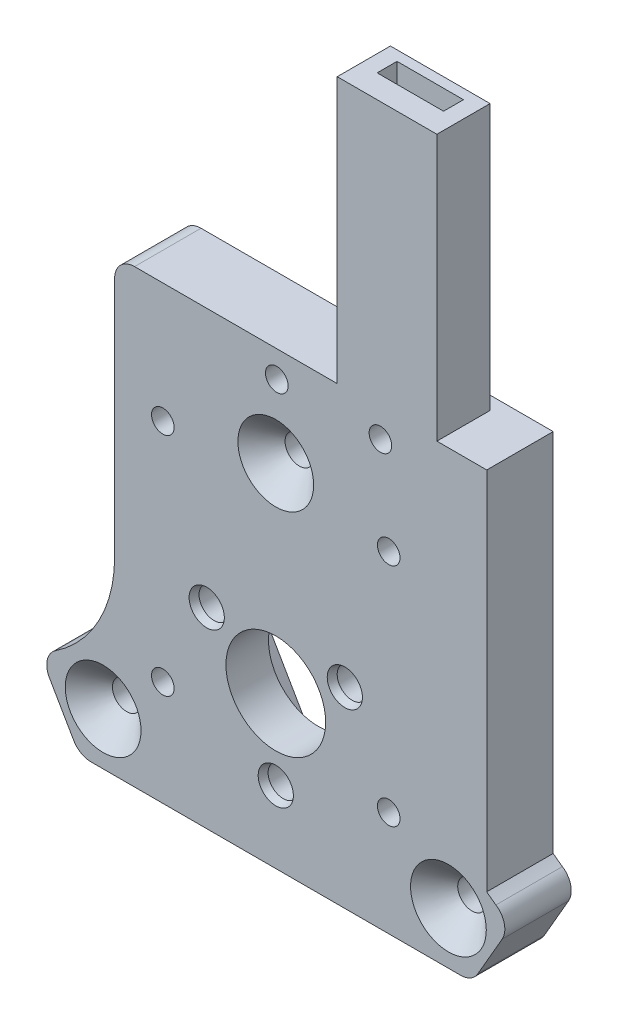
from build123d import *

# Parameters (mm, degrees)
SKETCH2_R                                       = 7.5
BOSS_EXTRUDE1_DEPTH                             = 10
CSK_FOR_M4_FLAT_HEAD_MACHINE_SCREW1_D           = 4.3
CSK_FOR_M4_FLAT_HEAD_MACHINE_SCREW1_CSINK_D     = 11.4
CSK_FOR_M4_FLAT_HEAD_MACHINE_SCREW1_CSINK_ANGLE = 90
FILLET1_R                                       = 20
V_GROOVE_CUTOUT_DEPTH                           = 3.6
STANDARD_TAPERED_INSERT_CUTOUT_DEPTH            = 59.209110795
STANDARD_TAPERED_INSERT_CUTOUT_DEPTH_BACK       = 59.209110795
SKETCH13_R                                      = 2.25
TAPER_FOR_INSERTS_SIZE                          = 0.4
TAPER_FOR_INSERTS_SIZE2                         = 1.098990968
MOVE_FACE1_BY                                   = 0.5
MOVE_FACE1_2_BY                                 = 0.5
MOVE_FACE1_3_BY                                 = 0.5
MOVE_FACE1_4_BY                                 = 0.5
MOVE_FACE1_5_BY                                 = 0.5
MOVE_FACE1_6_BY                                 = 0.5
CIRPATTERN2_COUNT                               = 3
FILLET2_R                                       = 3
SKETCH47_R                                      = 1.7
CUT_EXTRUDE1_DEPTH                              = 58.559983963
SKETCH49_W                                      = 15
SKETCH49_H                                      = 10
SKETCH49_W_2                                    = 10
SKETCH49_H_2                                    = 3
BOSS_EXTRUDE2_DEPTH                             = 40
CHAMFER1_SIZE                                   = 2
BOSS_EXTRUDE3_REACH                             = 78.74
SKETCH51_W                                      = 3
SKETCH51_H                                      = 10
BOSS_EXTRUDE4_DEPTH                             = 10
SKETCH48_R                                      = 1.7
CUT_EXTRUDE2_DEPTH                              = 93.266742447
CHAMFER4_SIZE                                   = 2
CHAMFER3_SIZE                                   = 2


with BuildPart() as part:
    # Sketch2 → Boss-Extrude1 (new body)
    with BuildSketch(Plane.XY):
        Polygon((-24.25, 45), (24.25, 45), (24.25, -5.917840259), (35.54293994, -12.437822174), (29.54293994, -22.830127019), (-29.54293994, -22.830127019), (-35.54293994, -12.437822174), (-24.25, -5.917840259), align=None)
        Circle(SKETCH2_R, mode=Mode.SUBTRACT)
    extrude(amount=BOSS_EXTRUDE1_DEPTH)

    # CSK for M4 Flat Head Machine Screw1 (through all)
    with Locations(Plane.XY.offset(10)):
        with Locations((-25.980762114, -15), (0, 30), (25.980762114, -15)):
            CounterSinkHole(CSK_FOR_M4_FLAT_HEAD_MACHINE_SCREW1_D / 2, CSK_FOR_M4_FLAT_HEAD_MACHINE_SCREW1_CSINK_D / 2, counter_sink_angle=CSK_FOR_M4_FLAT_HEAD_MACHINE_SCREW1_CSINK_ANGLE)

    # Fillet1
    fillet1_edges = [part.edges().sort_by_distance(p)[0] for p in [
        (24.25, -5.917840259, 5),
        (-24.25, -5.917840259, 5),
    ]]
    fillet(fillet1_edges, radius=FILLET1_R)

    # Sketch44 → v-groove cutout (cut)
    with BuildSketch(Plane(origin=(0, 0, 0), x_dir=(-1, 0, 0), z_dir=(0, 0, -1))):
        with BuildLine():
            Line((10.392304845, 10), (-10.392304845, 10))
            ThreePointArc((-10.392304845, 10), (-13.856406461, 8), (-13.856406461, 4))
            Line((-13.856406461, 4), (-3.464101615, -14))
            ThreePointArc((-3.464101615, -14), (0, -16), (3.464101615, -14))
            Line((3.464101615, -14), (13.856406461, 4))
            ThreePointArc((13.856406461, 4), (13.856406461, 8), (10.392304845, 10))
        make_face()
    extrude(amount=-V_GROOVE_CUTOUT_DEPTH, mode=Mode.SUBTRACT)

    # Sketch13 → standard tapered insert cutout (cut, two sides: drawn at the far end of the back side and taken through both)
    with BuildSketch(Plane(origin=(0, 0, 0), x_dir=(-1, 0, 0), z_dir=(0, 0, -1)).offset(-STANDARD_TAPERED_INSERT_CUTOUT_DEPTH_BACK)):
        with Locations((-10.392304845, 6)):
            Circle(SKETCH13_R)
        with Locations((10.392304845, 6)):
            Circle(SKETCH13_R)
        with Locations((0, -12)):
            Circle(SKETCH13_R)
    extrude(amount=STANDARD_TAPERED_INSERT_CUTOUT_DEPTH + STANDARD_TAPERED_INSERT_CUTOUT_DEPTH_BACK, mode=Mode.SUBTRACT)

    # taper for inserts
    taper_for_inserts_edges = [part.edges().sort_by_distance(p)[0] for p in [
        (12.642304845, 6, 10),
        (-8.142304845, 6, 10),
        (2.25, -12, 10),
    ]]
    taper_for_inserts_side = [part.faces().sort_by_distance(p)[0] for p in [
        (0, 10.687623267, 10),
    ]]
    chamfer(taper_for_inserts_edges, length=TAPER_FOR_INSERTS_SIZE, length2=TAPER_FOR_INSERTS_SIZE2, reference=taper_for_inserts_side[0])

    # Move Face1: a face moved inward by 0.5
    extrude(part.faces().sort_by_distance((-8.660254038, -5, 1.8))[0], amount=MOVE_FACE1_BY, dir=(-0.866025404, -0.5, 0), mode=Mode.SUBTRACT)

    # Move Face1 2: a curved face moved inward by 0.5
    add(Solid.thicken(part.faces().sort_by_distance((0, -16, 1.8))[0], -MOVE_FACE1_2_BY), mode=Mode.SUBTRACT)

    # Move Face1 3: a face moved inward by 0.5
    extrude(part.faces().sort_by_distance((8.660254038, -5, 1.8))[0], amount=MOVE_FACE1_3_BY, dir=(0.866025404, -0.5, 0), mode=Mode.SUBTRACT)

    # Move Face1 4: a curved face moved inward by 0.5
    add(Solid.thicken(part.faces().sort_by_distance((13.856406461, 8, 1.8))[0], -MOVE_FACE1_4_BY), mode=Mode.SUBTRACT)

    # Move Face1 5: a curved face moved inward by 0.5
    add(Solid.thicken(part.faces().sort_by_distance((-13.856406461, 8, 1.8))[0], -MOVE_FACE1_5_BY), mode=Mode.SUBTRACT)

    # Move Face1 6: a face moved inward by 0.5
    extrude(part.faces().sort_by_distance((0, 10, 1.8))[0], amount=MOVE_FACE1_6_BY, dir=(0, 1, 0), mode=Mode.SUBTRACT)

    # Sketch46 → tool ball cutout (revolve, cut)
    with BuildSketch(Plane(origin=(0, 30, 0), x_dir=(1, 0, 0), z_dir=(0, 1, 0))):
        with BuildLine():
            Line((0, 5.3), (0, -4.7))
            ThreePointArc((0, -4.7), (-5, 0.3), (0, 5.3))
        make_face()
    tool_ball_cutout = revolve(axis=Axis((0, 30, 0), (0, 0, -1)), mode=Mode.SUBTRACT)

    # CirPattern2: tool ball cutout ×3 about axis
    cirpattern2_axis = Axis((0, 0, 0), (0, 0, 1))
    for i in range(1, CIRPATTERN2_COUNT):
        add(tool_ball_cutout.rotate(cirpattern2_axis, i * 360 / CIRPATTERN2_COUNT), mode=Mode.SUBTRACT)

    # Fillet2
    fillet2_edges = [part.edges().sort_by_distance(p)[0] for p in [
        (24.25, 45, 5),
        (-24.25, 45, 5),
        (-29.54293994, -22.830127019, 5),
        (-35.54293994, -12.437822174, 5),
        (29.54293994, -22.830127019, 5),
        (35.54293994, -12.437822174, 5),
    ]]
    fillet(fillet2_edges, radius=FILLET2_R)

    # Sketch47 → Cut-Extrude1 (cut, through all)
    with BuildSketch(Plane(origin=(0, 0, 0), x_dir=(-1, 0, 0), z_dir=(0, 0, -1))):
        with Locations((-17, 27)):
            Circle(SKETCH47_R)
        with Locations((17, 27)):
            Circle(SKETCH47_R)
        with Locations((17, -7)):
            Circle(SKETCH47_R)
        with Locations((-17, -7)):
            Circle(SKETCH47_R)
    extrude(amount=-CUT_EXTRUDE1_DEPTH, mode=Mode.SUBTRACT)

    # Sketch49 → Boss-Extrude2 (add)
    with BuildSketch(Plane(origin=(0, 45, 0), x_dir=(1, 0, 0), z_dir=(0, 1, 0))):
        with Locations((16.75, -5)):
            Rectangle(SKETCH49_W, SKETCH49_H)
        with Locations((16.75, -5)):
            Rectangle(SKETCH49_W_2, SKETCH49_H_2, mode=Mode.SUBTRACT)
    extrude(amount=BOSS_EXTRUDE2_DEPTH)

    # Chamfer1
    chamfer1_edges = [part.edges().sort_by_distance(p)[0] for p in [
        (18.7, -7, 0),
        (-15.3, -7, 0),
        (-15.3, 27, 0),
        (18.7, 27, 0),
    ]]
    chamfer(chamfer1_edges, length=CHAMFER1_SIZE)

    # Sketch51 → Boss-Extrude3 (add, up to next)
    with BuildSketch(Plane.XZ.offset(-45), mode=Mode.PRIVATE) as boss_extrude3_sk1:
        with Locations((22.75, 5)):
            Rectangle(SKETCH51_W, SKETCH51_H)
    boss_extrude3_tool1 = extrude(boss_extrude3_sk1.sketch, amount=BOSS_EXTRUDE3_REACH, mode=Mode.PRIVATE) - part.part
    add(boss_extrude3_tool1.solids().sort_by_distance((22.75, 45, 5))[0])

    # Sketch52 → Boss-Extrude4 (add)
    with BuildSketch(Plane.XY.offset(10)):
        with BuildLine():
            Line((24.25, 45), (31.75, 45))
            Line((31.75, 45), (31.75, -9.983329871))
            ThreePointArc((31.75, -9.983329871), (26.222243623, -3.031088913), (24.25, 5.629165125))
            Line((24.25, 5.629165125), (24.25, 45))
        make_face()
    extrude(amount=-BOSS_EXTRUDE4_DEPTH)

    # Sketch48 → Cut-Extrude2 (cut, through all)
    with BuildSketch(Plane.XY.offset(10)):
        with Locations((0.150338606, 41)):
            Circle(SKETCH48_R)
        with Locations((15.750338606, 41)):
            Circle(SKETCH48_R)
    extrude(amount=-CUT_EXTRUDE2_DEPTH, mode=Mode.SUBTRACT)

    # Chamfer4
    chamfer4_edges = [part.edges().sort_by_distance(p)[0] for p in [
        (-1.549661394, 41, 0),
        (14.050338606, 41, 0),
    ]]
    chamfer(chamfer4_edges, length=CHAMFER4_SIZE)

    # Chamfer3
    chamfer3_edges = [part.edges().sort_by_distance(p)[0] for p in [
        (16.75, 85, 0),
        (9.25, 65, 0),
        (24.25, 65, 0),
    ]]
    chamfer(chamfer3_edges, length=CHAMFER3_SIZE)


solid = part.part
